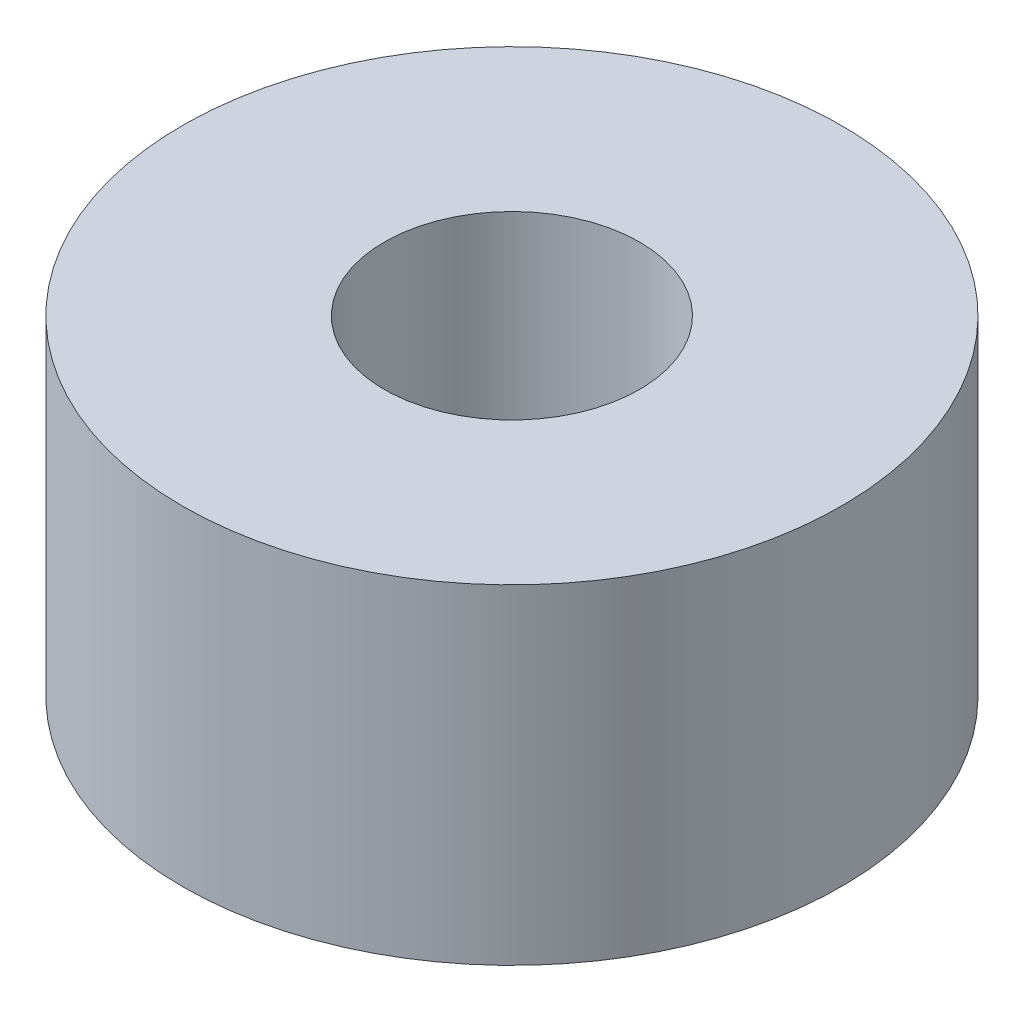
from build123d import *

# Parameters (mm, degrees)
SKETCH1_R              = 4
BOSS_EXTRUDE1_DEPTH    = 4
M2_5_CLEARANCE_HOLE1_D = 3.1


with BuildPart() as part:
    # Sketch1 → Boss-Extrude1 (new body)
    with BuildSketch(Plane(origin=(0, 0, 0), x_dir=(1, 0, 0), z_dir=(0, 1, 0))):
        with Locations(Location((0, 0, 0), (0, 0, 270))):
            Circle(SKETCH1_R)
    extrude(amount=BOSS_EXTRUDE1_DEPTH)

    # M2.5 Clearance Hole1 (through all)
    with Locations(Plane(origin=(0, 0, 0), x_dir=(-1, 0, 0), z_dir=(0, -1, 0))):
        with Locations((0, 0)):
            Hole(M2_5_CLEARANCE_HOLE1_D / 2)


solid = part.part
